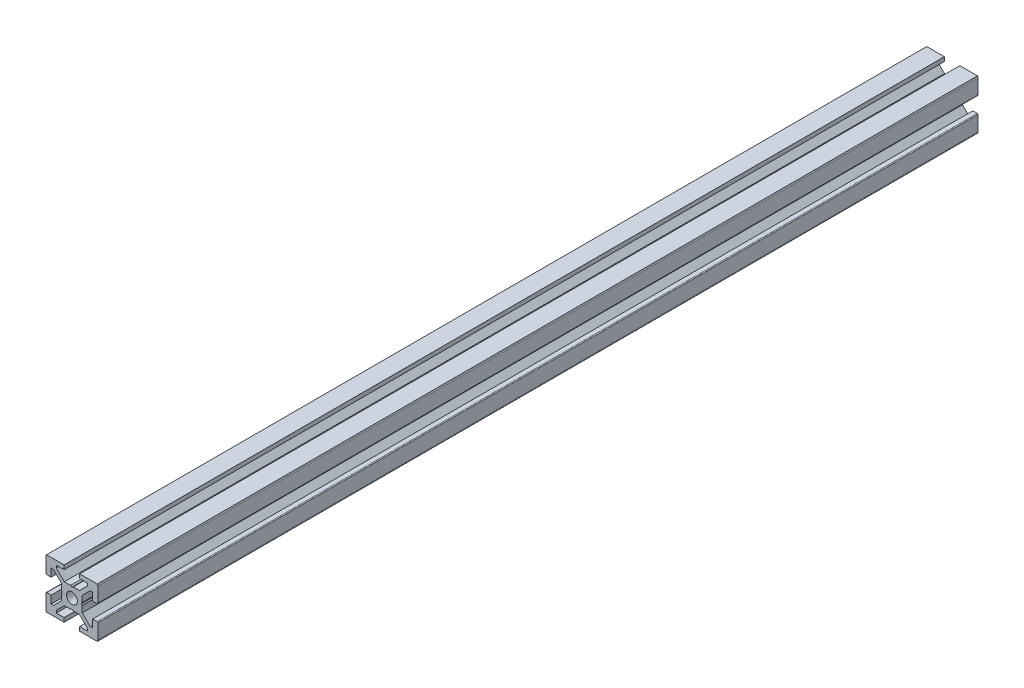
from build123d import *

# Parameters (mm, degrees)
SKETCH_3_R      = 2.0999999
EXTRUDE_1_DEPTH = 340


with BuildPart() as part:
    # 草图3 → 凸台-拉伸1 (new body)
    with BuildSketch(Plane.XY):
        with BuildLine():
            Line((57.060659494, 56.000000011), (54.000002413, 52.939342929))
            Line((54.000002413, 52.939342929), (54.000002413, 50.519633796))
            Line((54.000002413, 50.519633796), (53.700020897, 50.000006546))
            Line((53.700020897, 50.000006546), (54.000002413, 49.480359881))
            Line((54.000002413, 49.480359881), (54.000002413, 47.060657071))
            Line((54.000002413, 47.060657071), (57.060659494, 43.999999989))
            Line((57.060659494, 43.999999989), (57.999999993, 43.999999989))
            Line((57.999999993, 43.999999989), (57.999999993, 46.999999994))
            Line((57.999999993, 46.999999994), (59.699999997, 46.999999994))
            ThreePointArc((59.699999997, 46.999999994), (59.912132029, 46.912132029), (59.999999993, 46.699999998))
            Line((59.999999993, 46.699999998), (59.999999993, 41))
            ThreePointArc((59.999999993, 41), (59.948683291, 40.683772234), (59.799999994, 40.400000001))
            Line((59.799999994, 40.400000001), (52.999999994, 40.400000001))
            Line((52.999999994, 40.400000001), (52.999999994, 42))
            Line((52.999999994, 42), (55.999999999, 42))
            Line((55.999999999, 42), (55.999999999, 42.939340499))
            Line((55.999999999, 42.939340499), (52.939327623, 45.999997582))
            Line((52.939327623, 45.999997582), (50.519608524, 45.999997582))
            Line((50.519608524, 45.999997582), (49.99999391, 46.300000984))
            Line((49.99999391, 46.300000984), (49.48035988, 45.999997582))
            Line((49.48035988, 45.999997582), (47.06065707, 45.999997582))
            Line((47.06065707, 45.999997582), (43.99999999, 42.939340499))
            Line((43.99999999, 42.939340499), (43.99999999, 42))
            Line((43.99999999, 42), (46.999999994, 42))
            Line((46.999999994, 42), (46.999999994, 40.400000001))
            Line((46.999999994, 40.400000001), (40.199999995, 40.400000001))
            ThreePointArc((40.199999995, 40.400000001), (40.051316697, 40.683772234), (39.999999996, 41))
            Line((39.999999996, 41), (39.999999996, 46.699999998))
            ThreePointArc((39.999999996, 46.699999998), (40.08786796, 46.912132029), (40.299999991, 46.999999994))
            Line((40.299999991, 46.999999994), (41.999999996, 46.999999994))
            Line((41.999999996, 46.999999994), (41.999999996, 43.999999989))
            Line((41.999999996, 43.999999989), (42.939340495, 43.999999989))
            Line((42.939340495, 43.999999989), (45.999997575, 47.060657071))
            Line((45.999997575, 47.060657071), (45.999997575, 49.480366204))
            Line((45.999997575, 49.480366204), (46.300000986, 49.999980814))
            Line((46.300000986, 49.999980814), (45.999997575, 50.519614839))
            Line((45.999997575, 50.519614839), (45.999997575, 52.939323971))
            Line((45.999997575, 52.939323971), (42.939315735, 56.000000011))
            Line((42.939315735, 56.000000011), (41.999999996, 56.000000011))
            Line((41.999999996, 56.000000011), (41.999999996, 53.000000007))
            Line((41.999999996, 53.000000007), (40.299999991, 53.000000007))
            ThreePointArc((40.299999991, 53.000000007), (40.08786796, 53.087867971), (39.999999996, 53.300000003))
            Line((39.999999996, 53.300000003), (39.999999996, 59))
            ThreePointArc((39.999999996, 59), (40.051316697, 59.316227766), (40.199999995, 59.6))
            Line((40.199999995, 59.6), (46.999999994, 59.6))
            Line((46.999999994, 59.6), (46.999999994, 58))
            Line((46.999999994, 58), (43.99999999, 58))
            Line((43.99999999, 58), (43.99999999, 57.060659501))
            Line((43.99999999, 57.060659501), (47.060664718, 53.999994771))
            Line((47.060664718, 53.999994771), (49.480367527, 53.999994771))
            Line((49.480367527, 53.999994771), (49.999987125, 53.7))
            Line((49.999987125, 53.7), (50.519626138, 53.999994771))
            Line((50.519626138, 53.999994771), (52.939335271, 53.999994771))
            Line((52.939335271, 53.999994771), (55.999999999, 57.060659501))
            Line((55.999999999, 57.060659501), (55.999999999, 58))
            Line((55.999999999, 58), (52.999999994, 58))
            Line((52.999999994, 58), (52.999999994, 59.6))
            Line((52.999999994, 59.6), (59.799999994, 59.6))
            ThreePointArc((59.799999994, 59.6), (59.948683291, 59.316227766), (59.999999993, 59))
            Line((59.999999993, 59), (59.999999993, 53.300000003))
            ThreePointArc((59.999999993, 53.300000003), (59.912132029, 53.087867971), (59.699999997, 53.000000007))
            Line((59.699999997, 53.000000007), (57.999999993, 53.000000007))
            Line((57.999999993, 53.000000007), (57.999999993, 56.000000011))
            Line((57.999999993, 56.000000011), (57.060659494, 56.000000011))
        make_face()
        with Locations((50, 50)):
            Circle(SKETCH_3_R, mode=Mode.SUBTRACT)
    extrude(amount=EXTRUDE_1_DEPTH)


solid = part.part
